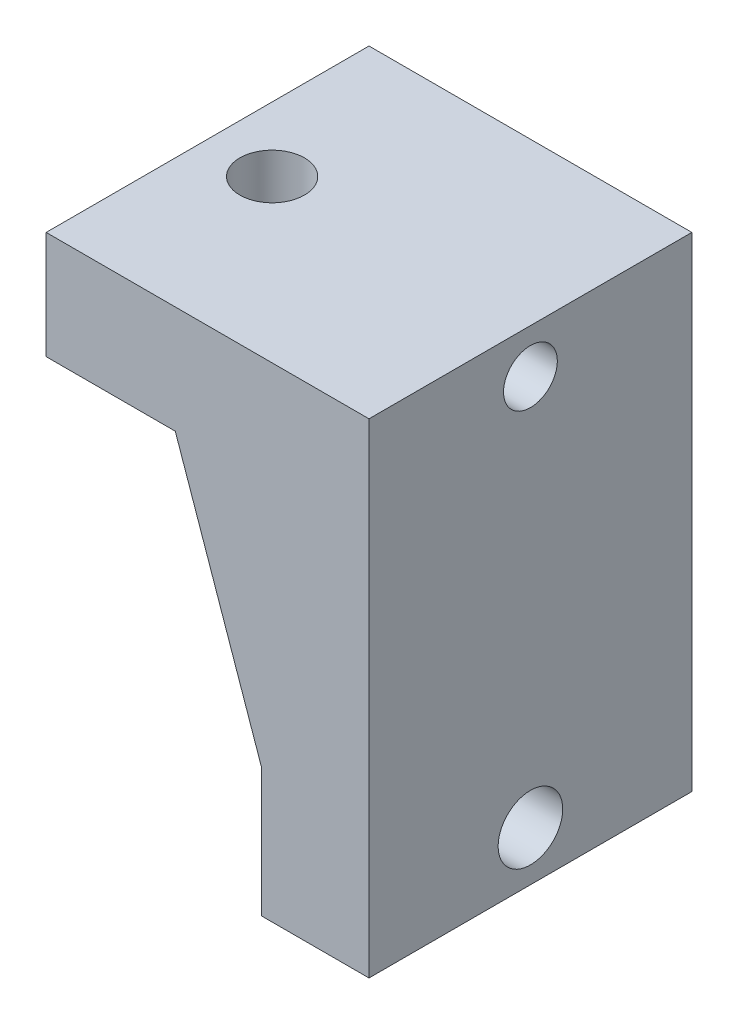
from build123d import *

# Parameters (mm, degrees)
SKIZZE1_W                       = 5
SKIZZE1_H                       = 5
AUFSATZ_LINEAR_AUSTRAGEN1_DEPTH = 15
SKIZZE2_R                       = 1.25
SKIZZE2_R_2                     = 1.5
SCHNITT_LINEAR_AUSTRAGEN1_DEPTH = 9
SKIZZE3_R                       = 1.5
SCHNITT_LINEAR_AUSTRAGEN2_DEPTH = 9


with BuildPart() as part:
    # Skizze1 → Aufsatz-Linear austragen1 (new body)
    with BuildSketch(Plane.XY):
        Polygon((-7.5, -2.5), (-1.5, -2.5), (2.5, -2.5), (2.5, 2.5), (-7.5, 2.5), align=None)
        with Locations((5, 0)):
            Rectangle(SKIZZE1_W, SKIZZE1_H)
        Polygon((2.5, -2.5), (-1.5, -2.5), (2.5, -14), align=None)
        Polygon((2.5, -2.5), (2.5, -14), (2.5, -20), (7.5, -20), (7.5, -2.5), align=None)
    extrude(amount=AUFSATZ_LINEAR_AUSTRAGEN1_DEPTH)

    # Skizze2 → Schnitt-Linear austragen1 (cut)
    with BuildSketch(Plane(origin=(7.5, 0, 0), x_dir=(0, 0, -1), z_dir=(1, 0, 0))):
        with Locations(Location((-7.5, 0.45, 0), (0, 0, 90))):
            Circle(SKIZZE2_R)
        with Locations(Location((-7.5, -17.7, 0), (0, 0, 90))):
            Circle(SKIZZE2_R_2)
    extrude(amount=-SCHNITT_LINEAR_AUSTRAGEN1_DEPTH, mode=Mode.SUBTRACT)

    # Skizze3 → Schnitt-Linear austragen2 (cut)
    with BuildSketch(Plane.XZ.offset(2.5)):
        with Locations(Location((-4.5, 7.5, 0), (0, 0, 270))):
            Circle(SKIZZE3_R)
    extrude(amount=-SCHNITT_LINEAR_AUSTRAGEN2_DEPTH, mode=Mode.SUBTRACT)


solid = part.part
